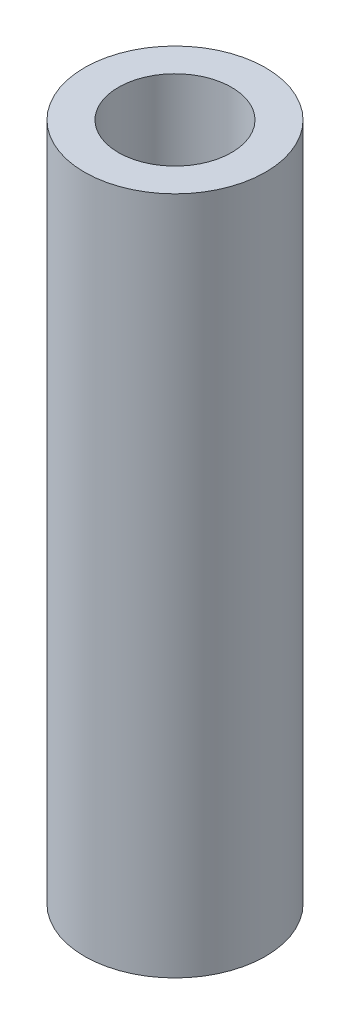
from build123d import *

# Parameters (mm, degrees)
SKETCH1_R           = 4
BOSS_EXTRUDE1_DEPTH = 30
SKETCH2_R           = 2.5
CUT_EXTRUDE1_DEPTH  = 31.528675045


with BuildPart() as part:
    # Sketch1 → Boss-Extrude1 (new body)
    with BuildSketch(Plane(origin=(0, 0, 0), x_dir=(1, 0, 0), z_dir=(0, 1, 0))):
        with Locations(Location((0, 0, 0), (0, 0, 270))):
            Circle(SKETCH1_R)
    extrude(amount=BOSS_EXTRUDE1_DEPTH)

    # Sketch2 → Cut-Extrude1 (cut, through all)
    with BuildSketch(Plane(origin=(0, 30, 0), x_dir=(1, 0, 0), z_dir=(0, 1, 0))):
        with Locations(Location((0, 0, 0), (0, 0, 270))):
            Circle(SKETCH2_R)
    extrude(amount=-CUT_EXTRUDE1_DEPTH, mode=Mode.SUBTRACT)


solid = part.part
